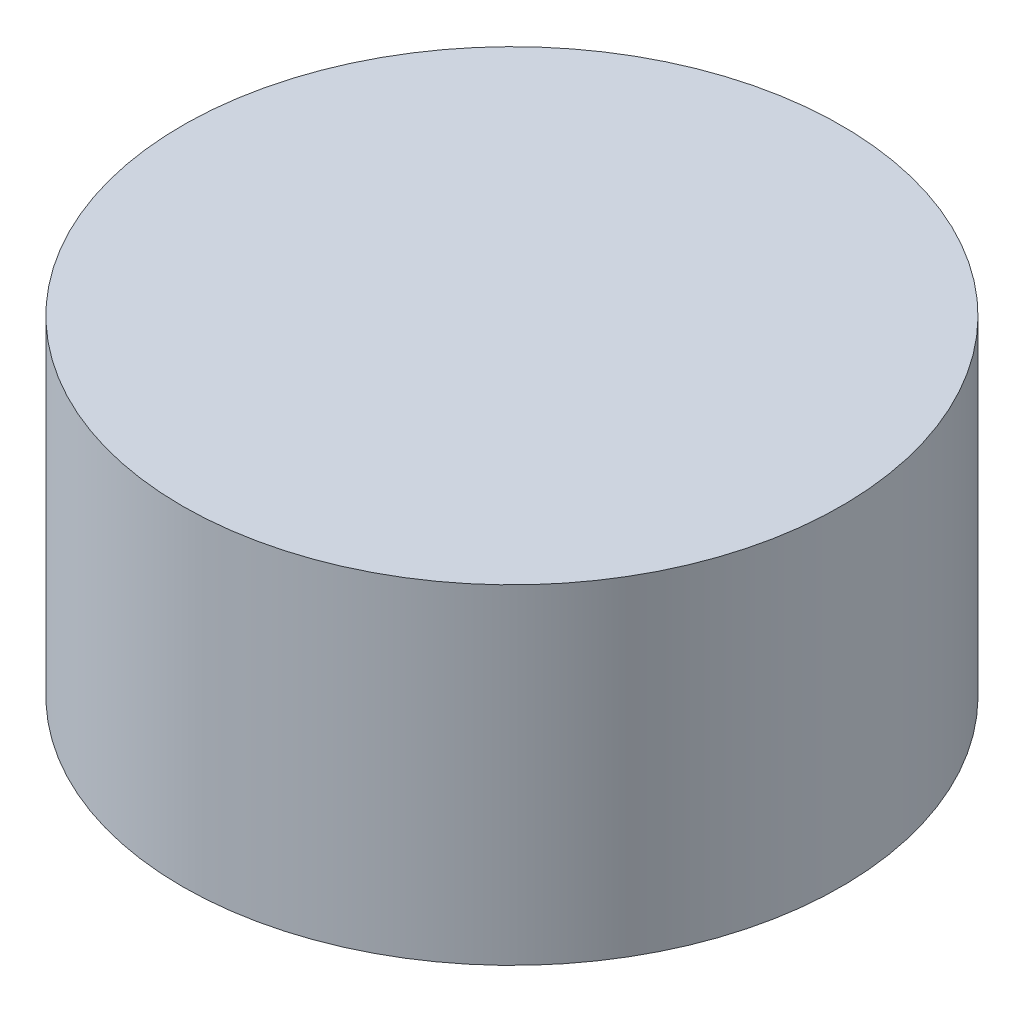
from build123d import *

# Parameters (mm, degrees)
SKETCH1_R           = 15
BOSS_EXTRUDE1_DEPTH = 15
SKETCH2_W           = 2.7
SKETCH2_H           = 7.4
CUT_EXTRUDE1_DEPTH  = 5


with BuildPart() as part:
    # Sketch1 → Boss-Extrude1 (new body)
    with BuildSketch(Plane(origin=(0, 0, 0), x_dir=(1, 0, 0), z_dir=(0, 1, 0))):
        Circle(SKETCH1_R)
    extrude(amount=BOSS_EXTRUDE1_DEPTH)

    # Sketch2 → Cut-Extrude1 (cut)
    with BuildSketch(Plane.XZ):
        with Locations((-11.35, 0)):
            Rectangle(SKETCH2_W, SKETCH2_H)
        with Locations((11.35, 0)):
            Rectangle(SKETCH2_W, SKETCH2_H)
    extrude(amount=-CUT_EXTRUDE1_DEPTH, mode=Mode.SUBTRACT)


solid = part.part
